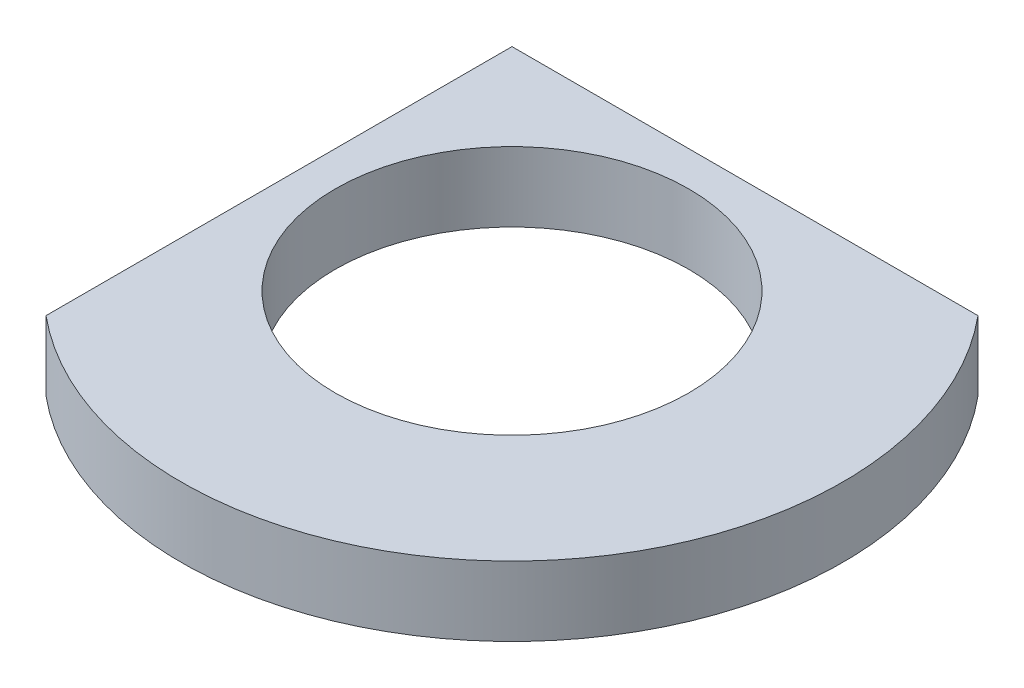
from build123d import *

# Parameters (mm, degrees)
SKETCH_1_R          = 19
SKETCH_1_R_2        = 10.15
EXTRUDE_2_DEPTH     = 4
SKETCH_3_W          = 38
SKETCH_3_H          = 10
CUT_EXTRUDE_8_DEPTH = 28.166155414
SKETCH_4_W          = 10
SKETCH_4_H          = 31.15
CUT_EXTRUDE_9_DEPTH = 28.166155414


with BuildPart() as part:
    # 草图1 → 凸台-拉伸2 (new body)
    with BuildSketch(Plane(origin=(0, 0, 0), x_dir=(1, 0, 0), z_dir=(0, 1, 0))):
        with Locations(Location((0, 0, 0), (0, 0, 270))):
            Circle(SKETCH_1_R)
        with Locations(Location((0, 0, 0), (0, 0, 270))):
            Circle(SKETCH_1_R_2, mode=Mode.SUBTRACT)
    extrude(amount=EXTRUDE_2_DEPTH)

    # 草图3 → 切除-拉伸8 (cut, through all)
    with BuildSketch(Plane(origin=(0, 4, 0), x_dir=(1, 0, 0), z_dir=(0, 1, 0))):
        with Locations((0, 17.15)):
            Rectangle(SKETCH_3_W, SKETCH_3_H)
    extrude(amount=-CUT_EXTRUDE_8_DEPTH, mode=Mode.SUBTRACT)

    # 草图4 → 切除-拉伸9 (cut, through all)
    with BuildSketch(Plane(origin=(0, 4, 0), x_dir=(1, 0, 0), z_dir=(0, 1, 0))):
        with Locations((-17.15, -3.425)):
            Rectangle(SKETCH_4_W, SKETCH_4_H)
    extrude(amount=-CUT_EXTRUDE_9_DEPTH, mode=Mode.SUBTRACT)


solid = part.part
